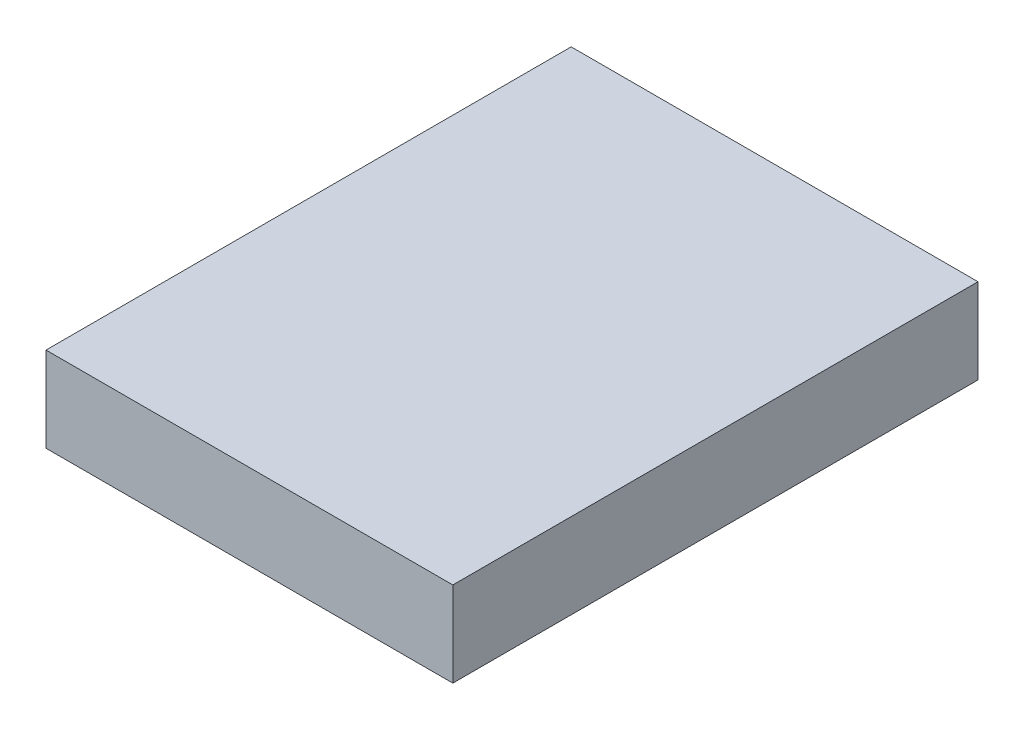
from build123d import *

# Parameters (mm, degrees)
SKETCH1_W           = 55
SKETCH1_H           = 71
BOSS_EXTRUDE1_DEPTH = 11.5


with BuildPart() as part:
    # Sketch1 → Boss-Extrude1 (new body)
    with BuildSketch(Plane(origin=(0, 0, 0), x_dir=(1, 0, 0), z_dir=(0, 1, 0))):
        with Locations((27.5, 35.5)):
            Rectangle(SKETCH1_W, SKETCH1_H)
    extrude(amount=BOSS_EXTRUDE1_DEPTH)


solid = part.part
